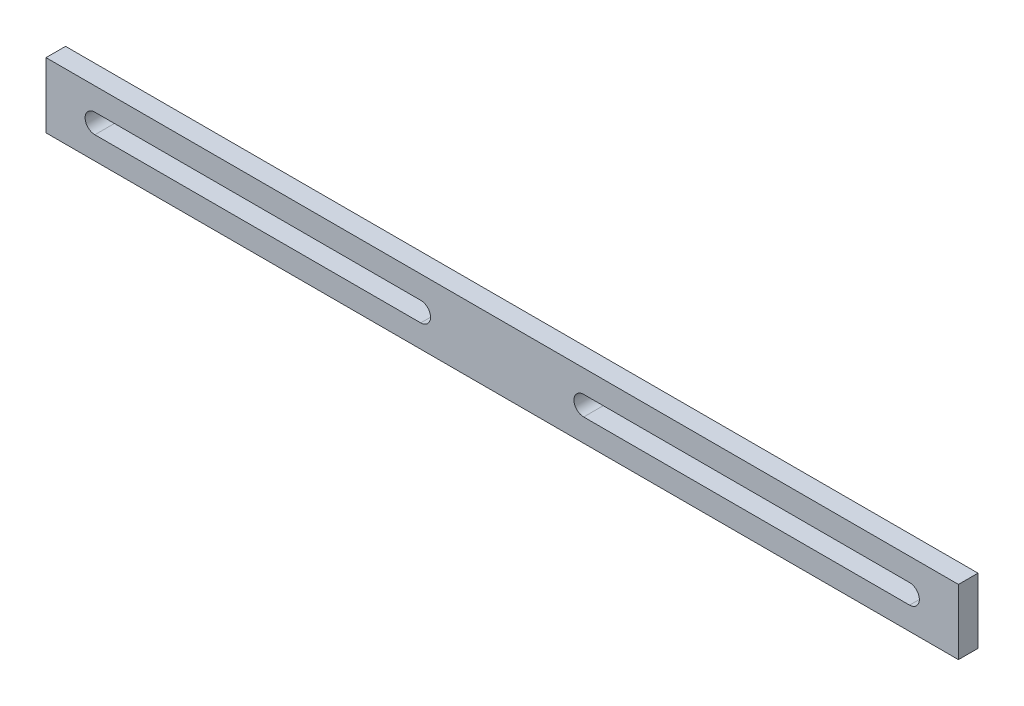
from build123d import *

# Parameters (mm, degrees)
SKETCH_1_W      = 280
SKETCH_1_H      = 20
EXTRUDE_2_DEPTH = 6


with BuildPart() as part:
    # 草图1 → 凸台-拉伸2 (new body)
    with BuildSketch(Plane.XY):
        with Locations((140, 10)):
            Rectangle(SKETCH_1_W, SKETCH_1_H)
        with BuildLine():
            Line((15, 13), (115, 13))
            ThreePointArc((115, 13), (118, 10), (115, 7))
            Line((115, 7), (15, 7))
            ThreePointArc((15, 7), (12, 10), (15, 13))
        make_face(mode=Mode.SUBTRACT)
        with BuildLine():
            Line((265, 13), (165, 13))
            ThreePointArc((165, 13), (162, 10), (165, 7))
            Line((165, 7), (265, 7))
            ThreePointArc((265, 7), (268, 10), (265, 13))
        make_face(mode=Mode.SUBTRACT)
    extrude(amount=EXTRUDE_2_DEPTH)


solid = part.part
